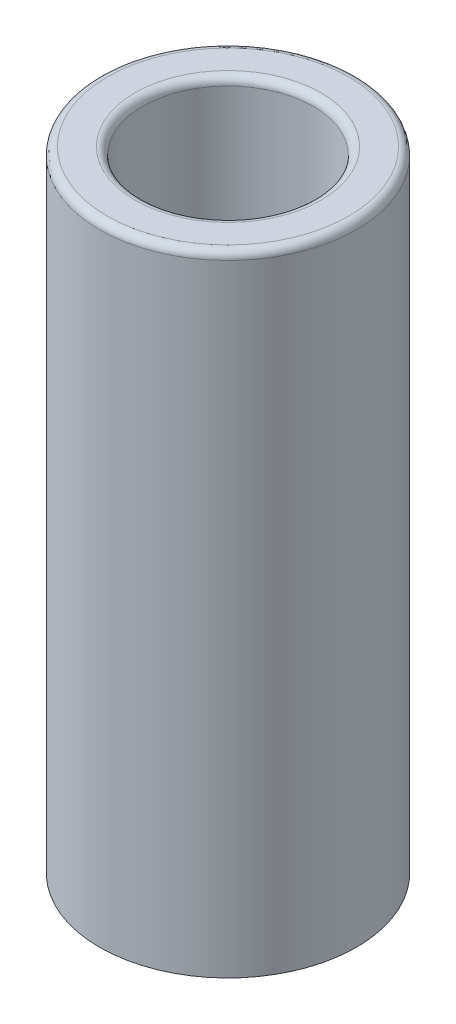
from build123d import *

# Parameters (mm, degrees)
SKETCH1_R           = 2.45
SKETCH1_R_2         = 1.625
BOSS_EXTRUDE1_DEPTH = 12
SKETCH1_4_R         = 1.625
BOSS_EXTRUDE2_DEPTH = 3
FILLET1_R           = 0.15


with BuildPart() as part:
    # Sketch1 → Boss-Extrude1 (new body)
    with BuildSketch(Plane(origin=(0, 0, 0), x_dir=(1, 0, 0), z_dir=(0, 1, 0))):
        with Locations(Location((0, 0, 0), (0, 0, 270))):
            Circle(SKETCH1_R)
        with Locations(Location((0, 0, 0), (0, 0, 270))):
            Circle(SKETCH1_R_2, mode=Mode.SUBTRACT)
    extrude(amount=BOSS_EXTRUDE1_DEPTH)

    # Sketch1<4> → Boss-Extrude2 (add)
    with BuildSketch(Plane(origin=(0, 0, 0), x_dir=(1, 0, 0), z_dir=(0, 1, 0))):
        with Locations(Location((0, 0, 0), (0, 0, 270))):
            Circle(SKETCH1_4_R)
    extrude(amount=BOSS_EXTRUDE2_DEPTH)

    # Fillet1
    fillet1_edges = [part.edges().sort_by_distance(p)[0] for p in [
        (0, 12, -2.45),
        (0, 12, -1.625),
    ]]
    fillet(fillet1_edges, radius=FILLET1_R)


solid = part.part
